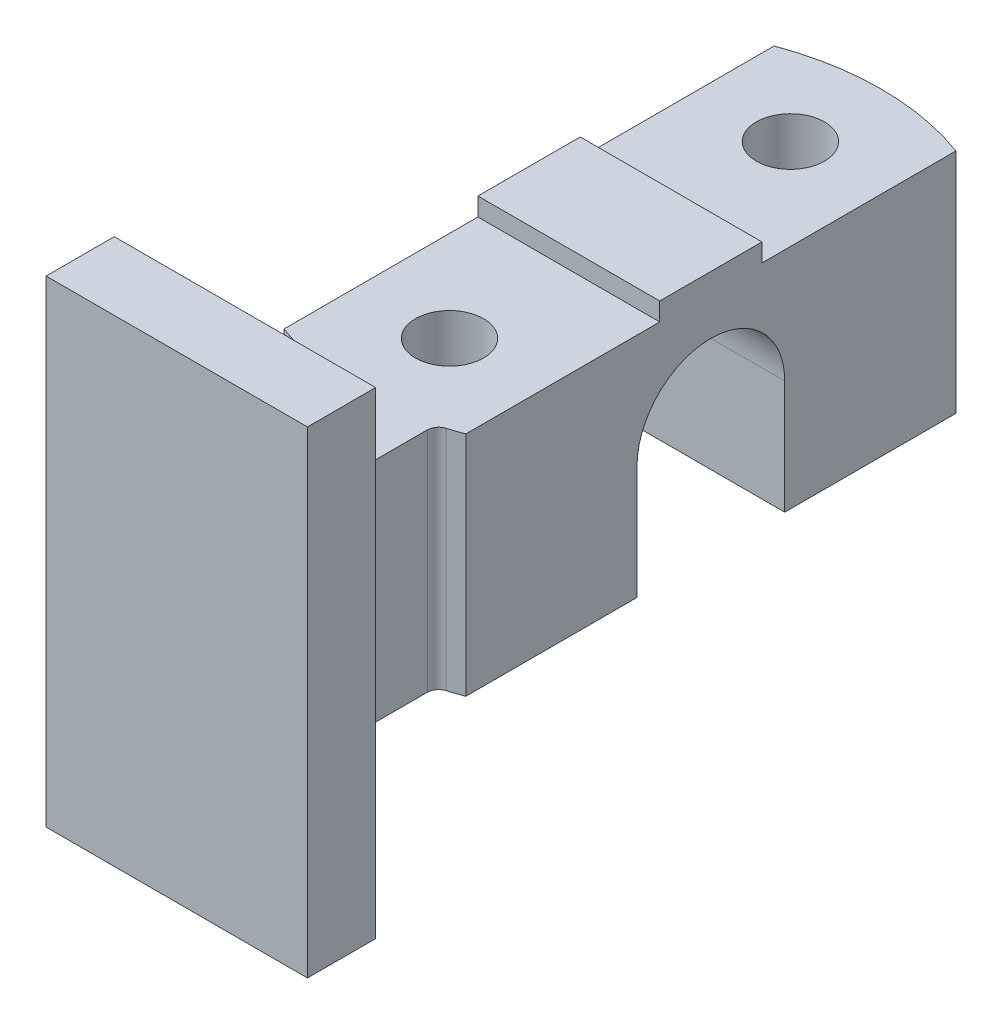
from build123d import *

# Parameters (mm, degrees)
SKETCH1_R           = 15
BOSS_EXTRUDE1_DEPTH = 50
BOSS_EXTRUDE2_DEPTH = 105
SKETCH4_W           = 80
SKETCH4_H           = 45
BOSS_EXTRUDE4_DEPTH = 8
SKETCH5_W           = 80
SKETCH5_H           = 45
CUT_EXTRUDE1_DEPTH  = 8
CUT_EXTRUDE2_DEPTH  = 242.983987074
FILLET1_R           = 20


with BuildPart() as part:
    # Sketch1 → Boss-Extrude1 (new, symmetric)
    with BuildSketch(Plane(origin=(0, 0, 0), x_dir=(1, 0, 0), z_dir=(0, 1, 0))):
        with BuildLine():
            ThreePointArc((-30, -145), (-35.857864376, -159.142135624), (-50, -165))
            Line((-50, -165), (50, -165))
            ThreePointArc((50, -165), (35.857864376, -159.142135624), (30, -145))
            Line((30, -145), (30, -114.782402832))
            ThreePointArc((30, -114.782402832), (30.981812183, -111.806807654), (33.541666667, -109.999802714))
            ThreePointArc((33.541666667, -109.999802714), (36.786992802, -108.957409847), (40, -107.819293264))
            Line((40, -107.819293264), (40, 107.819293264))
            ThreePointArc((40, 107.819293264), (0, 115), (-40, 107.819293264))
            Line((-40, 107.819293264), (-40, -107.819293264))
            ThreePointArc((-40, -107.819293264), (-36.786992802, -108.957409847), (-33.541666667, -109.999802714))
            ThreePointArc((-33.541666667, -109.999802714), (-30.981812183, -111.806807654), (-30, -114.782402832))
            Line((-30, -114.782402832), (-30, -145))
        make_face()
        with Locations((0, -75)):
            Circle(SKETCH1_R, mode=Mode.SUBTRACT)
        with Locations((0, 75)):
            Circle(SKETCH1_R, mode=Mode.SUBTRACT)
    extrude(amount=BOSS_EXTRUDE1_DEPTH, both=True)

    # Sketch1<3> → Boss-Extrude2 (add, symmetric)
    with BuildSketch(Plane(origin=(0, 0, 0), x_dir=(1, 0, 0), z_dir=(0, 1, 0))):
        Polygon((-50, -165), (-57.5, -165), (-57.5, -195), (57.5, -195), (57.5, -165), (50, -165), align=None)
    extrude(amount=BOSS_EXTRUDE2_DEPTH, both=True)

    # Sketch4 → Boss-Extrude4 (add)
    with BuildSketch(Plane(origin=(0, 50, 0), x_dir=(1, 0, 0), z_dir=(0, 1, 0))):
        Rectangle(SKETCH4_W, SKETCH4_H)
    extrude(amount=BOSS_EXTRUDE4_DEPTH)

    # Sketch5 → Cut-Extrude1 (cut)
    with BuildSketch(Plane.XZ.offset(50)):
        Rectangle(SKETCH5_W, SKETCH5_H)
    extrude(amount=-CUT_EXTRUDE1_DEPTH, mode=Mode.SUBTRACT)

    # Sketch6 → Cut-Extrude2 (cut, through all)
    with BuildSketch(Plane.ZY.offset(40)):
        with BuildLine():
            Line((-32.5, 0), (-32.5, -50))
            Line((-32.5, -50), (32.5, -50))
            Line((32.5, -50), (32.5, 0))
            ThreePointArc((32.5, 0), (0, 32.5), (-32.5, 0))
        make_face()
    extrude(amount=-CUT_EXTRUDE2_DEPTH, mode=Mode.SUBTRACT)

    # Fillet1
    fillet1_edges = [part.edges().sort_by_distance(p)[0] for p in [
        (0, 50, 165),
        (0, -50, 165),
    ]]
    fillet(fillet1_edges, radius=FILLET1_R)


solid = part.part
